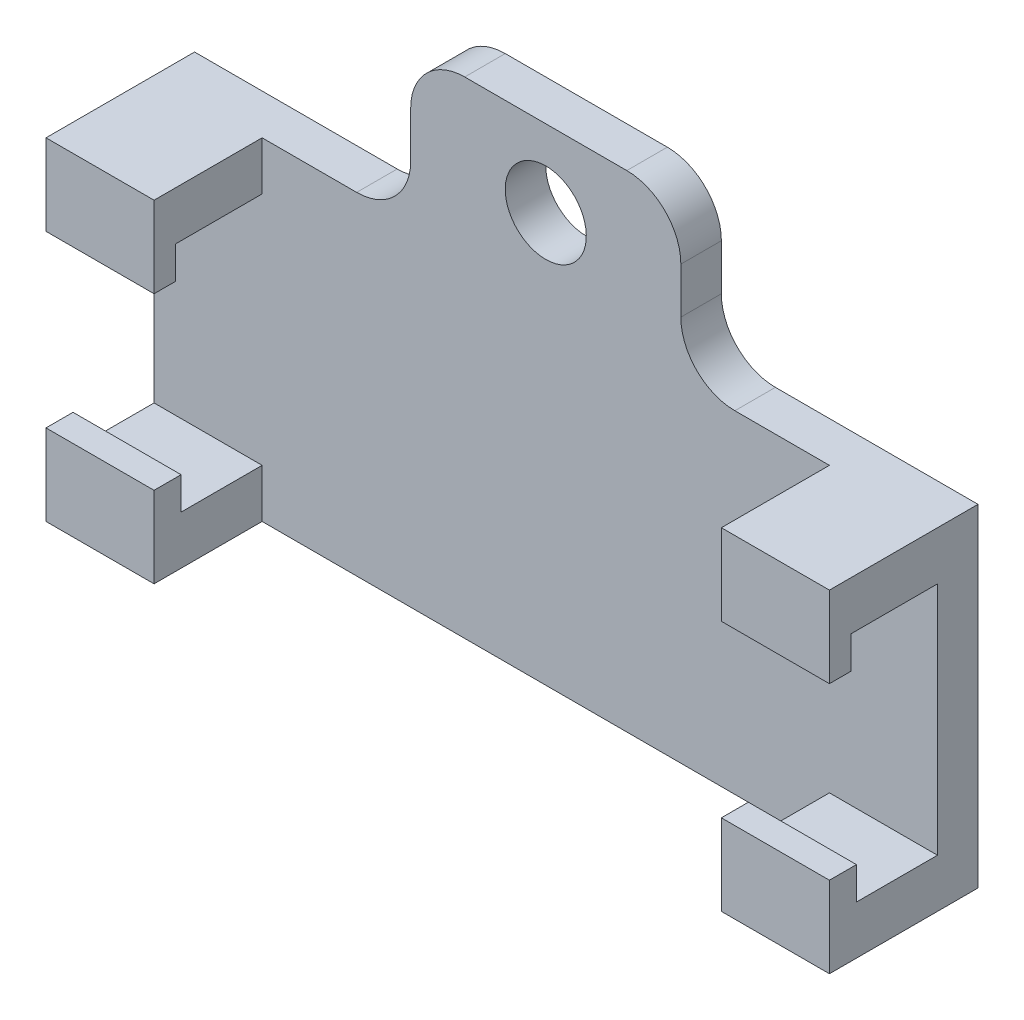
from build123d import *

# Parameters (mm, degrees)
SKETCH1_W             = 29
SKETCH1_H             = 23.7
BOSS_EXTRUDE1_DEPTH   = 1.5
SKETCH2_W             = 29
SKETCH2_H             = 3
BOSS_EXTRUDE2_DEPTH   = 4
SKETCH3_W             = 29
SKETCH3_H             = 3.2
CUT_EXTRUDE1_DEPTH    = 1.2
SKETCH4_W             = 29
SKETCH4_H             = 3
CUT_EXTRUDE2_DEPTH    = 1.2
SKETCH5_R             = 1.5
CUT_EXTRUDE3_DEPTH    = 38.665501457
SKETCH7_W             = 29
SKETCH7_H             = 5.7
CUT_EXTRUDE4_DEPTH    = 38.854193955
SKETCH8_W             = 21
SKETCH8_H             = 4
CUT_EXTRUDE5_DEPTH    = 35.572387826
SKETCH9_W             = 9.5
SKETCH9_H             = 5.7
CUT_EXTRUDE6_DEPTH    = 38.665501457
FILLET1_R             = 2
BODY_MOVE_COPY1_ANGLE = 90


with BuildPart() as part:
    # Sketch1 → Boss-Extrude1 (new body)
    with BuildSketch(Plane(origin=(0, 0, 0), x_dir=(1, 0, 0), z_dir=(0, 1, 0))):
        with Locations((14.5, 11.85)):
            Rectangle(SKETCH1_W, SKETCH1_H)
    extrude(amount=BOSS_EXTRUDE1_DEPTH)

    # Sketch2 → Boss-Extrude2 (add)
    with BuildSketch(Plane(origin=(0, 1.5, 0), x_dir=(1, 0, 0), z_dir=(0, 1, 0))):
        with Locations((14.5, 16.5)):
            Rectangle(SKETCH2_W, SKETCH2_H)
        with Locations((14.5, 7.2)):
            Rectangle(SKETCH2_W, SKETCH2_H)
    extrude(amount=BOSS_EXTRUDE2_DEPTH)

    # Sketch3 → Cut-Extrude1 (cut)
    with BuildSketch(Plane.XY.offset(-15)):
        with Locations((14.5, 3.1)):
            Rectangle(SKETCH3_W, SKETCH3_H)
    extrude(amount=-CUT_EXTRUDE1_DEPTH, mode=Mode.SUBTRACT)

    # Sketch4 → Cut-Extrude2 (cut)
    with BuildSketch(Plane(origin=(0, 0, -8.7), x_dir=(-1, 0, 0), z_dir=(0, 0, -1))):
        with Locations((-14.5, 3)):
            Rectangle(SKETCH4_W, SKETCH4_H)
    extrude(amount=-CUT_EXTRUDE2_DEPTH, mode=Mode.SUBTRACT)

    # Sketch5 → Cut-Extrude3 (cut, through all)
    with BuildSketch(Plane(origin=(0, 1.5, 0), x_dir=(1, 0, 0), z_dir=(0, 1, 0))):
        with Locations(Location((14.5, 20.85, 0), (0, 0, 270))):
            Circle(SKETCH5_R)
        with Locations(Location((14.5, 2.85, 0), (0, 0, 270))):
            Circle(SKETCH5_R)
    extrude(amount=-CUT_EXTRUDE3_DEPTH, mode=Mode.SUBTRACT)

    # Sketch7 → Cut-Extrude4 (cut, through all)
    with BuildSketch(Plane(origin=(0, 0, 0), x_dir=(1, 0, 0), z_dir=(0, 1, 0))):
        with Locations((14.5, 2.85)):
            Rectangle(SKETCH7_W, SKETCH7_H)
    extrude(amount=CUT_EXTRUDE4_DEPTH, mode=Mode.SUBTRACT)

    # Sketch8 → Cut-Extrude5 (cut, through all)
    with BuildSketch(Plane.XY.offset(-5.7)):
        with Locations((14.5, 3.5)):
            Rectangle(SKETCH8_W, SKETCH8_H)
    extrude(amount=-CUT_EXTRUDE5_DEPTH, mode=Mode.SUBTRACT)

    # Sketch9 → Cut-Extrude6 (cut, through all)
    with BuildSketch(Plane(origin=(0, 1.5, 0), x_dir=(1, 0, 0), z_dir=(0, 1, 0))):
        with Locations((4.75, 20.85)):
            Rectangle(SKETCH9_W, SKETCH9_H)
        with Locations((24.25, 20.85)):
            Rectangle(SKETCH9_W, SKETCH9_H)
    extrude(amount=-CUT_EXTRUDE6_DEPTH, mode=Mode.SUBTRACT)

    # Fillet1
    fillet1_edges = [part.edges().sort_by_distance(p)[0] for p in [
        (9.5, 0.75, -23.7),
        (9.5, 0.75, -18),
        (19.5, 0.75, -23.7),
        (19.5, 0.75, -18),
    ]]
    fillet(fillet1_edges, radius=FILLET1_R)


with BuildPart() as part_1:
    # Body-Move/Copy1: moved
    add(part.part.rotate(Axis((0, 2.75, -20.7), (1, 0, 0)), BODY_MOVE_COPY1_ANGLE))


solid = part_1.part
